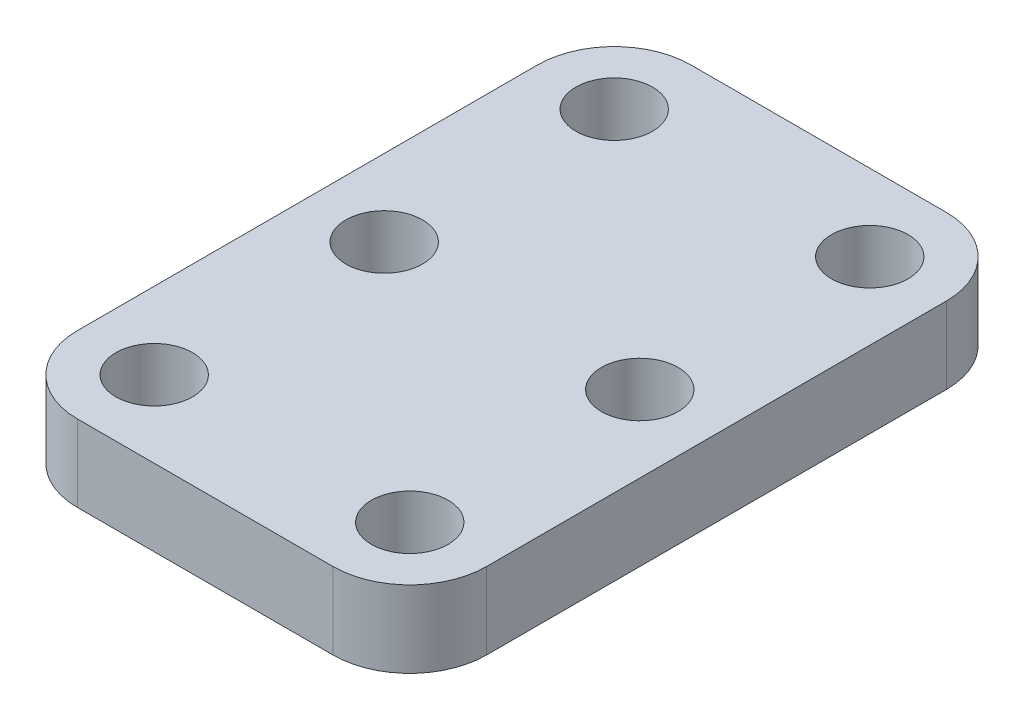
from build123d import *

# Parameters (mm, degrees)
ESBO_O1_W                = 80
ESBO_O1_H                = 120
RESSALTO_EXTRUS_O1_DEPTH = 15
FILETE1_R                = 15
ESBO_O2_R                = 7.5
CORTE_EXTRUS_O1_DEPTH    = 146


with BuildPart() as part:
    # Esboço1 → Ressalto-extrusão1 (new body)
    with BuildSketch(Plane(origin=(0, 0, 0), x_dir=(1, 0, 0), z_dir=(0, 1, 0))):
        with Locations((40, 60)):
            Rectangle(ESBO_O1_W, ESBO_O1_H)
    extrude(amount=RESSALTO_EXTRUS_O1_DEPTH)

    # Filete1
    filete1_edges = [part.edges().sort_by_distance(p)[0] for p in [
        (0, 7.5, -120),
        (80, 7.5, -120),
        (80, 7.5, 0),
        (0, 7.5, 0),
    ]]
    fillet(filete1_edges, radius=FILETE1_R)

    # Esboço2 → Corte-extrusão1 (cut, through all)
    with BuildSketch(Plane(origin=(0, 15, 0), x_dir=(1, 0, 0), z_dir=(0, 1, 0))):
        with Locations(Location((15, 105, 0), (0, 0, 270))):
            Circle(ESBO_O2_R)
        with Locations(Location((65, 105, 0), (0, 0, 270))):
            Circle(ESBO_O2_R)
        with Locations(Location((65, 60, 0), (0, 0, 270))):
            Circle(ESBO_O2_R)
        with Locations(Location((65, 15, 0), (0, 0, 270))):
            Circle(ESBO_O2_R)
        with Locations(Location((15, 60, 0), (0, 0, 270))):
            Circle(ESBO_O2_R)
        with Locations(Location((15, 15, 0), (0, 0, 270))):
            Circle(ESBO_O2_R)
    extrude(amount=-CORTE_EXTRUS_O1_DEPTH, mode=Mode.SUBTRACT)


solid = part.part
